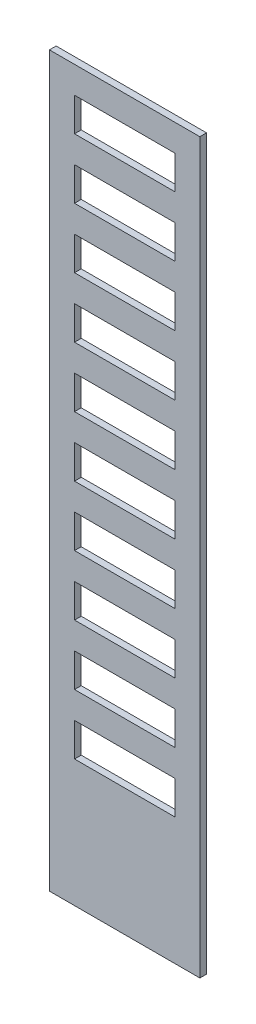
from build123d import *

# Parameters (mm, degrees)
SKETCH1_W           = 7.5
SKETCH1_H           = 8
SKETCH1_H_2         = 10
SKETCH1_W_2         = 30
BOSS_EXTRUDE1_DEPTH = 2
SKETCH2_W           = 45
SKETCH2_H           = 30
BOSS_EXTRUDE2_DEPTH = 2


with BuildPart() as part:
    # Sketch1 → Boss-Extrude1 (new body)
    with BuildSketch(Plane.XY):
        with Locations((-18.75, 90)):
            Rectangle(SKETCH1_W, SKETCH1_H)
        with Locations((-18.75, 81)):
            Rectangle(SKETCH1_W, SKETCH1_H_2)
        with Locations((-18.75, 72)):
            Rectangle(SKETCH1_W, SKETCH1_H)
        with Locations((-18.75, 63)):
            Rectangle(SKETCH1_W, SKETCH1_H_2)
        with Locations((-18.75, 54)):
            Rectangle(SKETCH1_W, SKETCH1_H)
        with Locations((-18.75, 45)):
            Rectangle(SKETCH1_W, SKETCH1_H_2)
        with Locations((0, 90)):
            Rectangle(SKETCH1_W_2, SKETCH1_H)
        with Locations((18.75, 90)):
            Rectangle(SKETCH1_W, SKETCH1_H)
        with Locations((18.75, 81)):
            Rectangle(SKETCH1_W, SKETCH1_H_2)
        with Locations((18.75, 72)):
            Rectangle(SKETCH1_W, SKETCH1_H)
        with Locations((0, 72)):
            Rectangle(SKETCH1_W_2, SKETCH1_H)
        with Locations((0, 54)):
            Rectangle(SKETCH1_W_2, SKETCH1_H)
        with Locations((18.75, 54)):
            Rectangle(SKETCH1_W, SKETCH1_H)
        with Locations((18.75, 63)):
            Rectangle(SKETCH1_W, SKETCH1_H_2)
        with Locations((18.75, 45)):
            Rectangle(SKETCH1_W, SKETCH1_H_2)
        with Locations((18.75, 36)):
            Rectangle(SKETCH1_W, SKETCH1_H)
        with Locations((0, 36)):
            Rectangle(SKETCH1_W_2, SKETCH1_H)
        with Locations((-18.75, 36)):
            Rectangle(SKETCH1_W, SKETCH1_H)
        with Locations((-18.75, 27)):
            Rectangle(SKETCH1_W, SKETCH1_H_2)
        with Locations((-18.75, 18)):
            Rectangle(SKETCH1_W, SKETCH1_H)
        with Locations((-18.75, 9)):
            Rectangle(SKETCH1_W, SKETCH1_H_2)
        with Locations((-18.75, 0)):
            Rectangle(SKETCH1_W, SKETCH1_H)
        Rectangle(SKETCH1_W_2, SKETCH1_H)
        with Locations((18.75, 0)):
            Rectangle(SKETCH1_W, SKETCH1_H)
        with Locations((18.75, 9)):
            Rectangle(SKETCH1_W, SKETCH1_H_2)
        with Locations((18.75, 18)):
            Rectangle(SKETCH1_W, SKETCH1_H)
        with Locations((0, 18)):
            Rectangle(SKETCH1_W_2, SKETCH1_H)
        with Locations((18.75, 27)):
            Rectangle(SKETCH1_W, SKETCH1_H_2)
        with Locations((-18.75, -9)):
            Rectangle(SKETCH1_W, SKETCH1_H_2)
        with Locations((-18.75, -18)):
            Rectangle(SKETCH1_W, SKETCH1_H)
        with Locations((-18.75, -27)):
            Rectangle(SKETCH1_W, SKETCH1_H_2)
        with Locations((-18.75, -36)):
            Rectangle(SKETCH1_W, SKETCH1_H)
        with Locations((-18.75, -45)):
            Rectangle(SKETCH1_W, SKETCH1_H_2)
        with Locations((0, -36)):
            Rectangle(SKETCH1_W_2, SKETCH1_H)
        with Locations((0, -18)):
            Rectangle(SKETCH1_W_2, SKETCH1_H)
        with Locations((18.75, -18)):
            Rectangle(SKETCH1_W, SKETCH1_H)
        with Locations((18.75, -9)):
            Rectangle(SKETCH1_W, SKETCH1_H_2)
        with Locations((18.75, -27)):
            Rectangle(SKETCH1_W, SKETCH1_H_2)
        with Locations((18.75, -36)):
            Rectangle(SKETCH1_W, SKETCH1_H)
        with Locations((-18.75, -54)):
            Rectangle(SKETCH1_W, SKETCH1_H)
        with Locations((-18.75, -63)):
            Rectangle(SKETCH1_W, SKETCH1_H_2)
        with Locations((-18.75, -72)):
            Rectangle(SKETCH1_W, SKETCH1_H)
        with Locations((-18.75, -81)):
            Rectangle(SKETCH1_W, SKETCH1_H_2)
        with Locations((-18.75, -90)):
            Rectangle(SKETCH1_W, SKETCH1_H)
        with Locations((0, -90)):
            Rectangle(SKETCH1_W_2, SKETCH1_H)
        with Locations((18.75, -90)):
            Rectangle(SKETCH1_W, SKETCH1_H)
        with Locations((18.75, -81)):
            Rectangle(SKETCH1_W, SKETCH1_H_2)
        with Locations((18.75, -72)):
            Rectangle(SKETCH1_W, SKETCH1_H)
        with Locations((18.75, -63)):
            Rectangle(SKETCH1_W, SKETCH1_H_2)
        with Locations((18.75, -54)):
            Rectangle(SKETCH1_W, SKETCH1_H)
        with Locations((18.75, -45)):
            Rectangle(SKETCH1_W, SKETCH1_H_2)
        with Locations((0, -54)):
            Rectangle(SKETCH1_W_2, SKETCH1_H)
        with Locations((0, -72)):
            Rectangle(SKETCH1_W_2, SKETCH1_H)
    extrude(amount=BOSS_EXTRUDE1_DEPTH)

    # Sketch2 → Boss-Extrude2 (add)
    with BuildSketch(Plane.XY.offset(2)):
        with Locations((0, -109)):
            Rectangle(SKETCH2_W, SKETCH2_H)
    extrude(amount=-BOSS_EXTRUDE2_DEPTH)


solid = part.part
